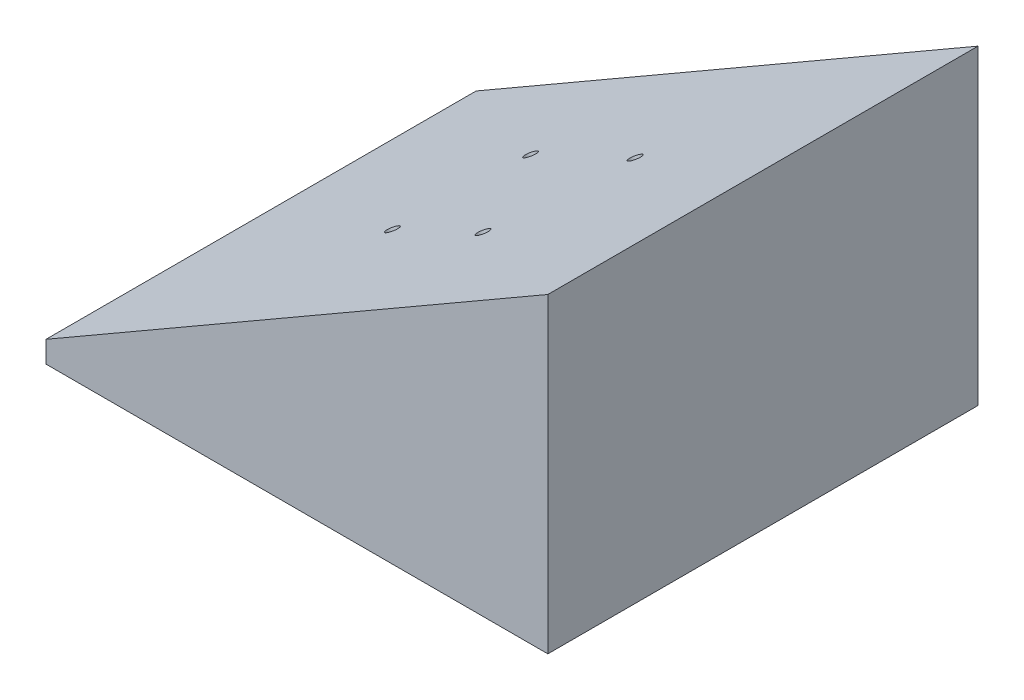
from build123d import *

# Parameters (mm, degrees)
EXTRUDE_1_DEPTH     = 60
SKETCH_2_R          = 0.85
CUT_EXTRUDE_1_DEPTH = 30


with BuildPart() as part:
    # 草图1 → 凸台-拉伸1 (new body)
    with BuildSketch(Plane.XY):
        Polygon((0, 0), (70, 0), (70, 43.414518843), (0, 3), align=None)
    extrude(amount=EXTRUDE_1_DEPTH)

    # 草图2 → 切除-拉伸1 (cut, symmetric)
    with BuildSketch(Plane(origin=(-1.299038106, 2.25, 0), x_dir=(0.8660254037844386, 0.5, 0), z_dir=(-0.5000000000000001, 0.8660254037844387, 0))):
        with Locations(Location((32.793518843, -19.503, 0), (0, 0, 180))):
            Circle(SKETCH_2_R)
        with Locations(Location((53.801518843, -23.123, 0), (0, 0, 180))):
            Circle(SKETCH_2_R)
        with Locations(Location((49.374518843, -40.502, 0), (0, 0, 180))):
            Circle(SKETCH_2_R)
        with Locations(Location((31.173518843, -37.391, 0), (0, 0, 180))):
            Circle(SKETCH_2_R)
    extrude(amount=CUT_EXTRUDE_1_DEPTH, both=True, mode=Mode.SUBTRACT)


solid = part.part
